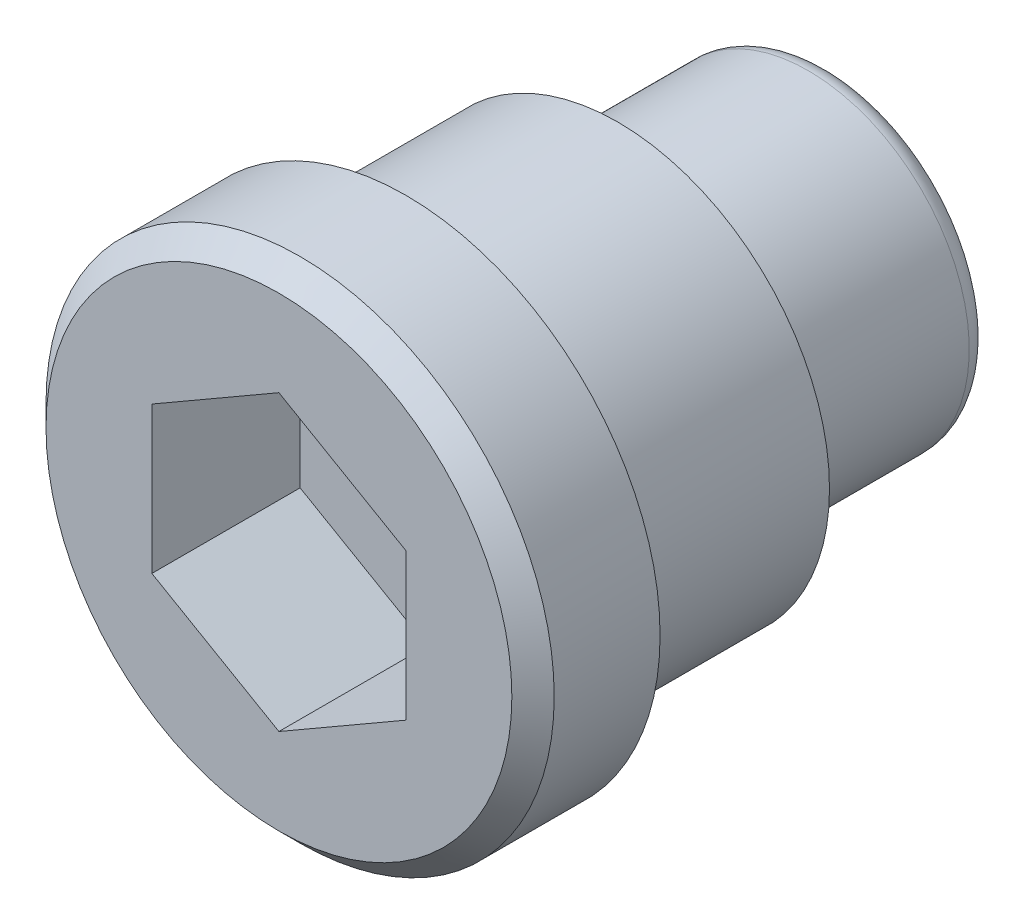
from build123d import *

# Parameters (mm, degrees)
SKETCH2_R           = 5
BOSS_EXTRUDE1_DEPTH = 5
SKETCH3_R           = 3.8
BOSS_EXTRUDE2_DEPTH = 5
CUT_EXTRUDE1_DEPTH  = 3.5
FILLET1_R           = 0.5


with BuildPart() as part:
    # Sketch1 → Revolve1 (revolve)
    with BuildSketch(Plane.XZ, mode=Mode.PRIVATE) as revolve1_sk:
        Polygon((5.5, 0), (0, 0), (0, -3), (6, -3), (6, -0.5), align=None)
    revolve(revolve1_sk.sketch.rotate(Axis((0, 0, 0), (0, 0, -1)), 180), axis=Axis((0, 0, 0), (0, 0, -1)))

    # Sketch2 → Boss-Extrude1 (add)
    with BuildSketch(Plane(origin=(0, 0, -3), x_dir=(-1, 0, 0), z_dir=(0, 0, -1))):
        Circle(SKETCH2_R)
    extrude(amount=BOSS_EXTRUDE1_DEPTH)

    # Sketch3 → Boss-Extrude2 (add)
    with BuildSketch(Plane(origin=(0, 0, -8), x_dir=(-1, 0, 0), z_dir=(0, 0, -1))):
        Circle(SKETCH3_R)
    extrude(amount=BOSS_EXTRUDE2_DEPTH)

    # Sketch4 → Cut-Extrude1 (cut)
    with BuildSketch(Plane.XY):
        Polygon((3, 1.732050808), (0, 3.464101615), (-3, 1.732050808), (-3, -1.732050808), (0, -3.464101615), (3, -1.732050808), align=None)
    extrude(amount=-CUT_EXTRUDE1_DEPTH, mode=Mode.SUBTRACT)

    # Fillet1
    fillet1_edges = [part.edges().sort_by_distance(p)[0] for p in [
        (3.8, 0, -13),
    ]]
    fillet(fillet1_edges, radius=FILLET1_R)


solid = part.part
